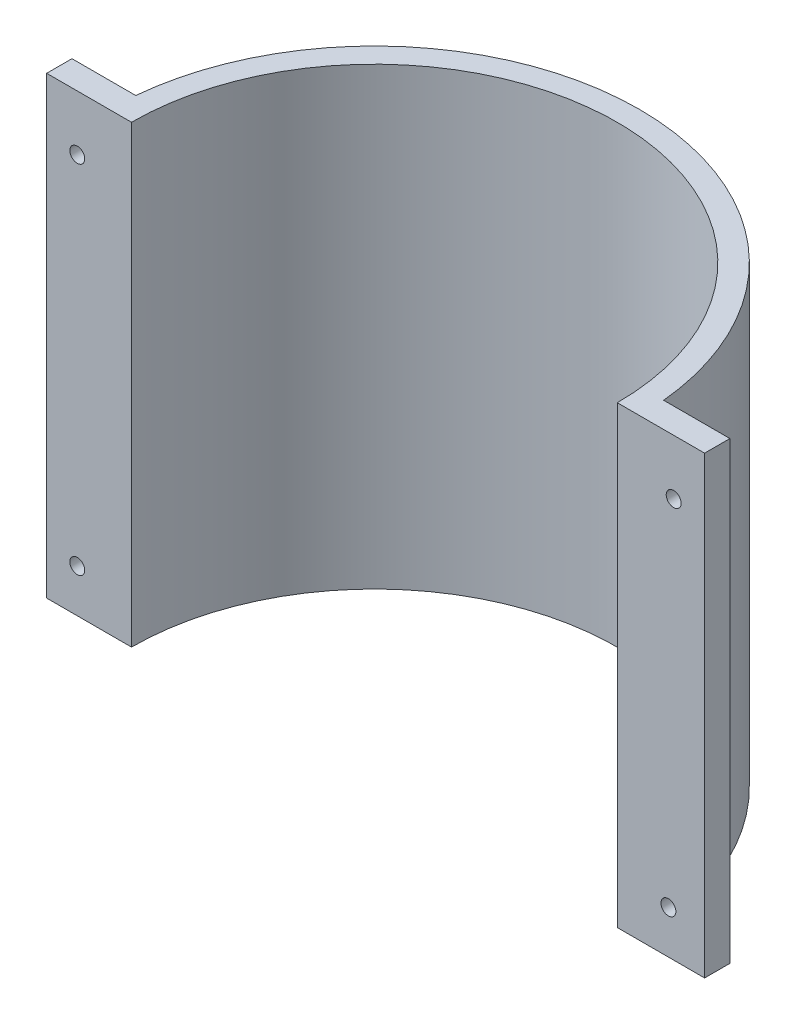
from build123d import *

# Parameters (mm, degrees)
BOSS_EXTRUDE1_DEPTH                   = 76.2
TAP_DRILL_FOR_M3X0_5_TAP1_D           = 2.5
TAP_DRILL_FOR_M3X0_5_TAP1_CSINK_D     = 2.55
TAP_DRILL_FOR_M3X0_5_TAP1_CSINK_ANGLE = 90


with BuildPart() as part:
    # Sketch1 → Boss-Extrude1 (new body)
    with BuildSketch(Plane(origin=(0, 0, 0), x_dir=(1, 0, 0), z_dir=(0, 1, 0))):
        with BuildLine():
            Line((-44.247201079, 4.24119048), (-54.936217795, 4.24119048))
            Line((-54.936217795, 4.24119048), (-54.936217795, 0))
            Line((-54.936217795, 0), (-40.716846583, 0))
            ThreePointArc((-40.716846583, 0), (0, 40.716846583), (40.716846583, 0))
            Line((40.716846583, 0), (55.359579402, 0))
            Line((55.359579402, 0), (55.359579402, 4.24119048))
            Line((55.359579402, 4.24119048), (44.247201079, 4.24119048))
            ThreePointArc((44.247201079, 4.24119048), (0, 44.45), (-44.247201079, 4.24119048))
        make_face()
    extrude(amount=BOSS_EXTRUDE1_DEPTH)

    # Tap Drill for M3x0.5 Tap1 (through all)
    with Locations(Plane(origin=(50.171881224, 66.945390665, -4.24119048), x_dir=(-1, 0, 0), z_dir=(0, 0, -1))):
        with Locations((0, 0), (0.880500078, -59.713914359), (99.976781548, -59.713914359), (99.976781548, 0)):
            CounterSinkHole(TAP_DRILL_FOR_M3X0_5_TAP1_D / 2, TAP_DRILL_FOR_M3X0_5_TAP1_CSINK_D / 2, counter_sink_angle=TAP_DRILL_FOR_M3X0_5_TAP1_CSINK_ANGLE)


solid = part.part
